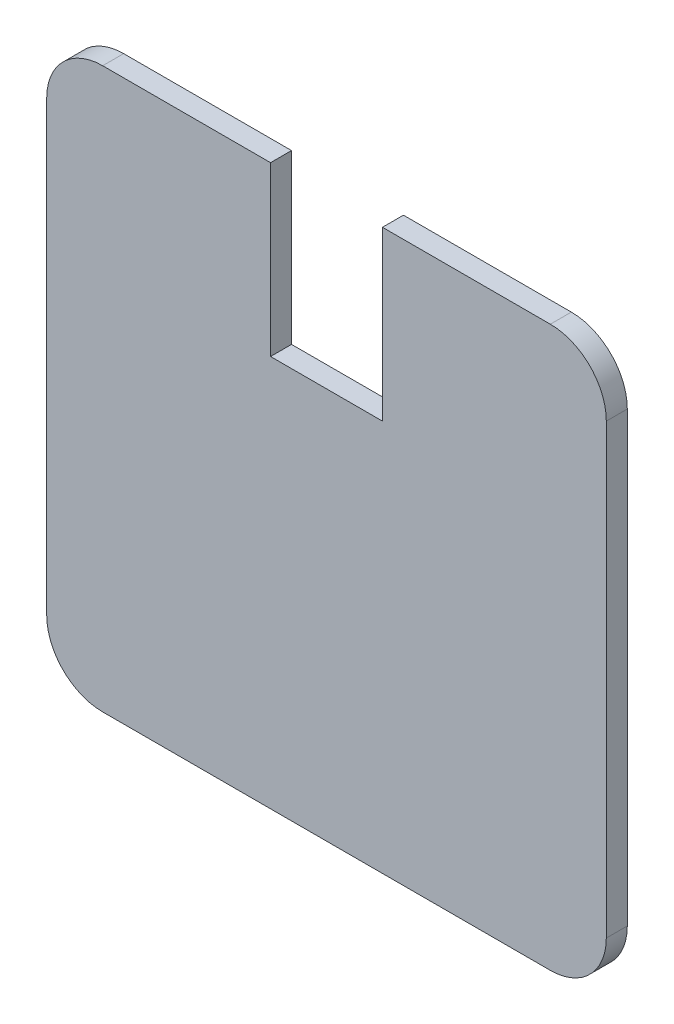
from build123d import *

# Parameters (mm, degrees)
BOSS_EXTRUDE1_DEPTH = 4.7625


with BuildPart() as part:
    # Sketch1 → Boss-Extrude1 (new body)
    with BuildSketch(Plane.XY):
        with BuildLine():
            Line((-63.5, 50.8), (-63.5, -50.8))
            ThreePointArc((-63.5, -50.8), (-59.780256121, -59.780256121), (-50.8, -63.5))
            Line((-50.8, -63.5), (50.8, -63.5))
            ThreePointArc((50.8, -63.5), (59.780256121, -59.780256121), (63.5, -50.8))
            Line((63.5, -50.8), (63.5, 50.8))
            ThreePointArc((63.5, 50.8), (59.780256121, 59.780256121), (50.8, 63.5))
            Line((50.8, 63.5), (12.7, 63.5))
            Line((12.7, 63.5), (12.7, 25.4))
            Line((12.7, 25.4), (-12.7, 25.4))
            Line((-12.7, 25.4), (-12.7, 63.5))
            Line((-12.7, 63.5), (-50.8, 63.5))
            ThreePointArc((-50.8, 63.5), (-59.780256121, 59.780256121), (-63.5, 50.8))
        make_face()
    extrude(amount=BOSS_EXTRUDE1_DEPTH)


solid = part.part
